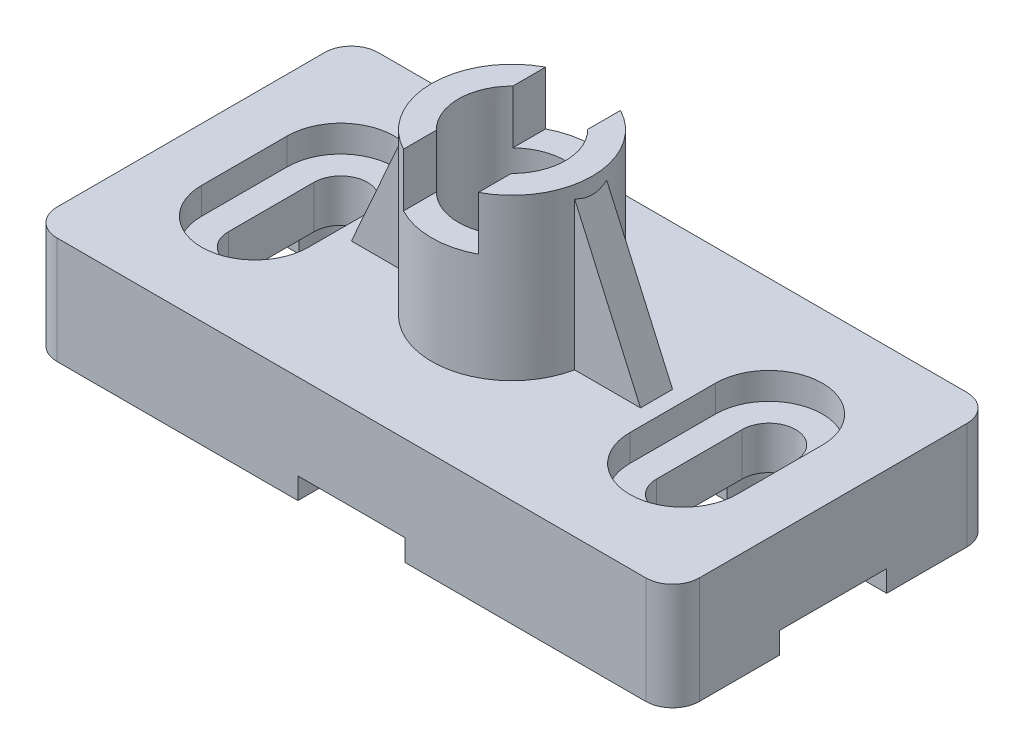
from build123d import *

# Parameters (mm, degrees)
SKETCH1_W           = 120
SKETCH1_H           = 20
BOSS_EXTRUDE1_DEPTH = 60
SKETCH2_R           = 15
BOSS_EXTRUDE2_DEPTH = 30
SKETCH3_R           = 5
CUT_EXTRUDE1_DEPTH  = 76
SKETCH4_R           = 10
CUT_EXTRUDE3_DEPTH  = 30
SKETCH5_W           = 40
SKETCH5_H           = 50
CUT_EXTRUDE5_DEPTH  = 7
SKETCH6_W           = 20
SKETCH6_H           = 8
CUT_EXTRUDE6_DEPTH  = 70
CUT_EXTRUDE7_DEPTH  = 5
CUT_EXTRUDE8_START  = -7
CUT_EXTRUDE8_DEPTH  = 7
CUT_EXTRUDE9_DEPTH  = 24
SKETCH11_W          = 120
SKETCH11_H          = 20
CUT_EXTRUDE10_DEPTH = 4
RIB10_REACH         = 80.102
SKETCH12_WALL_W     = 187.751566924
SKETCH12_WALL_H     = 6
RIB11_REACH         = 80.102
SKETCH13_WALL_W     = 187.751566924
SKETCH13_WALL_H     = 6
FILLET1_R           = 5
SKETCH14_W          = 14
SKETCH14_H          = 10
CUT_EXTRUDE13_DEPTH = 20


with BuildPart() as part:
    # Sketch1 → Boss-Extrude1 (new body)
    with BuildSketch(Plane.XY):
        Rectangle(SKETCH1_W, SKETCH1_H)
    extrude(amount=BOSS_EXTRUDE1_DEPTH)

    # Sketch2 → Boss-Extrude2 (add)
    with BuildSketch(Plane(origin=(0, 10, 0), x_dir=(1, 0, 0), z_dir=(0, 1, 0))):
        with Locations(Location((0, -30, 0), (0, 0, 90))):
            Circle(SKETCH2_R)
    extrude(amount=BOSS_EXTRUDE2_DEPTH)

    # Sketch3 → Cut-Extrude1 (cut)
    with BuildSketch(Plane(origin=(0, 40, 0), x_dir=(1, 0, 0), z_dir=(0, 1, 0))):
        with Locations(Location((0, -30, 0), (0, 0, 270))):
            Circle(SKETCH3_R)
    extrude(amount=-CUT_EXTRUDE1_DEPTH, mode=Mode.SUBTRACT)

    # Sketch4 → Cut-Extrude3 (cut)
    with BuildSketch(Plane(origin=(0, 40, 0), x_dir=(1, 0, 0), z_dir=(0, 1, 0))):
        with Locations(Location((0, -30, 0), (0, 0, 270))):
            Circle(SKETCH4_R)
    extrude(amount=-CUT_EXTRUDE3_DEPTH, mode=Mode.SUBTRACT)

    # Sketch5 → Cut-Extrude5 (cut)
    with BuildSketch(Plane.XZ.offset(10)):
        with Locations((0, 30)):
            Rectangle(SKETCH5_W, SKETCH5_H)
    extrude(amount=-CUT_EXTRUDE5_DEPTH, mode=Mode.SUBTRACT)

    # Sketch6 → Cut-Extrude6 (cut)
    with BuildSketch(Plane.XY.offset(60)):
        with Locations((0, -10)):
            Rectangle(SKETCH6_W, SKETCH6_H)
    extrude(amount=-CUT_EXTRUDE6_DEPTH, mode=Mode.SUBTRACT)

    # Sketch7 → Cut-Extrude7 (cut)
    with BuildSketch(Plane(origin=(0, 10, 0), x_dir=(1, 0, 0), z_dir=(0, 1, 0))):
        with BuildLine():
            Line((-30, -22), (-30, -38))
            ThreePointArc((-30, -38), (-40, -48), (-50, -38))
            Line((-50, -38), (-50, -22))
            ThreePointArc((-50, -22), (-40, -12), (-30, -22))
        make_face()
        with BuildLine():
            Line((50, -22), (50, -38))
            ThreePointArc((50, -38), (40, -48), (30, -38))
            Line((30, -38), (30, -22))
            ThreePointArc((30, -22), (40, -12), (50, -22))
        make_face()
    extrude(amount=-CUT_EXTRUDE7_DEPTH, mode=Mode.SUBTRACT)

    # Sketch9 → Cut-Extrude8 (cut)
    with BuildSketch(Plane.XZ.offset(10).offset(CUT_EXTRUDE8_START)):
        with BuildLine():
            Line((-30, 38), (-30, 22))
            ThreePointArc((-30, 22), (-40, 12), (-50, 22))
            Line((-50, 22), (-50, 38))
            ThreePointArc((-50, 38), (-40, 48), (-30, 38))
        make_face()
        with BuildLine():
            Line((50, 38), (50, 22))
            ThreePointArc((50, 22), (40, 12), (30, 22))
            Line((30, 22), (30, 38))
            ThreePointArc((30, 38), (40, 48), (50, 38))
        make_face()
    extrude(amount=CUT_EXTRUDE8_DEPTH, mode=Mode.SUBTRACT)

    # Sketch10 → Cut-Extrude9 (cut)
    with BuildSketch(Plane(origin=(0, 5, 0), x_dir=(1, 0, 0), z_dir=(0, 1, 0))):
        with BuildLine():
            Line((-45, -38), (-45, -22))
            ThreePointArc((-45, -22), (-40, -17), (-35, -22))
            Line((-35, -22), (-35, -38))
            ThreePointArc((-35, -38), (-40, -43), (-45, -38))
        make_face()
        with BuildLine():
            Line((45, -38), (45, -22))
            ThreePointArc((45, -22), (40, -17), (35, -22))
            Line((35, -22), (35, -38))
            ThreePointArc((35, -38), (40, -43), (45, -38))
        make_face()
    extrude(amount=-CUT_EXTRUDE9_DEPTH, mode=Mode.SUBTRACT)

    # Sketch11 → Cut-Extrude10 (cut)
    with BuildSketch(Plane.XZ.offset(10)):
        with Locations((0, 30)):
            Rectangle(SKETCH11_W, SKETCH11_H)
    extrude(amount=-CUT_EXTRUDE10_DEPTH, mode=Mode.SUBTRACT)

    # Sketch12 wall → Rib10 (add, up to next)
    with BuildSketch(Plane(origin=(-21, 23.5, 30), x_dir=(-0.406138466053, -0.91381154862, 0), z_dir=(0.91381154862, -0.406138466053, 0)), mode=Mode.PRIVATE) as rib10_sk1:
        Rectangle(SKETCH12_WALL_W, SKETCH12_WALL_H)
    rib10_tool1 = extrude(rib10_sk1.sketch, amount=RIB10_REACH, mode=Mode.PRIVATE) - part.part
    add(rib10_tool1.solids().sort_by_distance((-21, 23.5, 30))[0])

    # Sketch13 wall → Rib11 (add, up to next)
    with BuildSketch(Plane(origin=(21, 23.5, 30), x_dir=(0.406138466053, -0.91381154862, 0), z_dir=(0.91381154862, 0.406138466053, 0)), mode=Mode.PRIVATE) as rib11_sk1:
        Rectangle(SKETCH13_WALL_W, SKETCH13_WALL_H)
    rib11_tool1 = extrude(rib11_sk1.sketch, amount=-RIB11_REACH, mode=Mode.PRIVATE) - part.part
    add(rib11_tool1.solids().sort_by_distance((21, 23.5, 30))[0])

    # Fillet1
    fillet1_edges = [part.edges().sort_by_distance(p)[0] for p in [
        (-60, 0, 60),
        (60, 0, 60),
        (-60, 0, 0),
        (60, 0, 0),
    ]]
    fillet(fillet1_edges, radius=FILLET1_R)

    # Sketch14 → Cut-Extrude13 (cut, symmetric)
    with BuildSketch(Plane.XY.offset(30)):
        with Locations((0, 35)):
            Rectangle(SKETCH14_W, SKETCH14_H)
    extrude(amount=CUT_EXTRUDE13_DEPTH, both=True, mode=Mode.SUBTRACT)


solid = part.part
